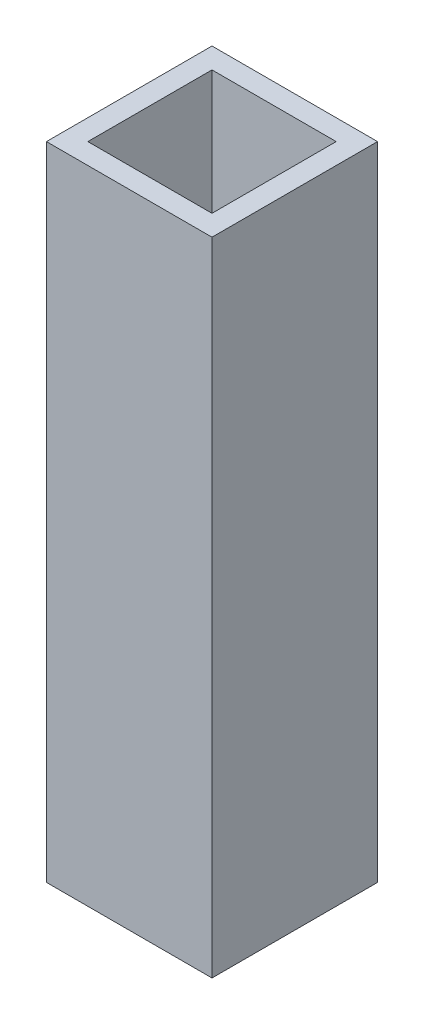
from build123d import *

# Parameters (mm, degrees)
SKETCH1_W           = 25.4
SKETCH1_H           = 25.4
SKETCH1_W_2         = 19.05
SKETCH1_H_2         = 19.05
BOSS_EXTRUDE1_DEPTH = 98.425


with BuildPart() as part:
    # Sketch1 → Boss-Extrude1 (new body)
    with BuildSketch(Plane(origin=(0, 0, 0), x_dir=(1, 0, 0), z_dir=(0, 1, 0))):
        with Locations((12.7, 12.7)):
            Rectangle(SKETCH1_W, SKETCH1_H)
        with Locations((12.7, 12.7)):
            Rectangle(SKETCH1_W_2, SKETCH1_H_2, mode=Mode.SUBTRACT)
    extrude(amount=BOSS_EXTRUDE1_DEPTH)


solid = part.part
